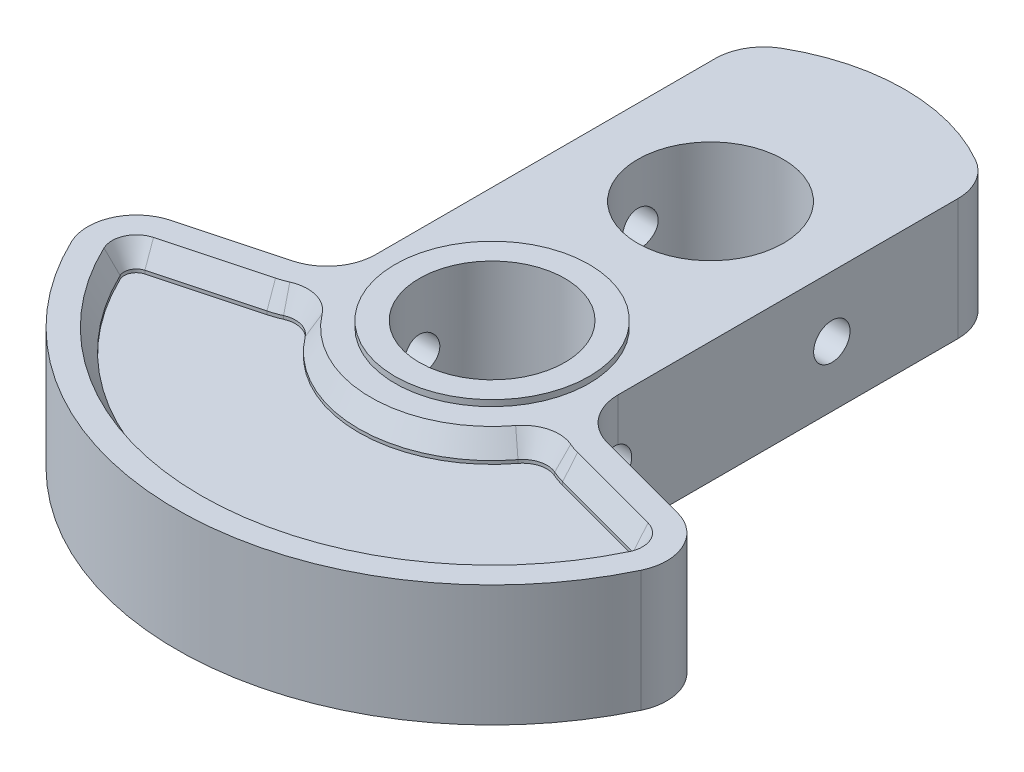
from build123d import *

# Parameters (mm, degrees)
BOSS_EXTRUDE1_DEPTH       = 5
FILLET1_R                 = 4
SKETCH2_R                 = 8
BOSS_EXTRUDE2_DEPTH       = 0.5
SKETCH3_R                 = 8
BOSS_EXTRUDE3_DEPTH       = 0.5
SKETCH4_R                 = 6
CUT_EXTRUDE1_DEPTH        = 43.969085178
CUT_EXTRUDE2_DEPTH        = 2
FILLET3_R                 = 2
CHAMFER1_SIZE             = 1
CHAMFER1_SIZE2            = 1.732050808
FILLET3_OF_MIRROR9_R      = 2
CHAMFER1_OF_MIRROR9_SIZE2 = 1.732050808
CHAMFER1_OF_MIRROR9_SIZE  = 1
CUT_EXTRUDE3_DEPTH        = 42.899788694
CUT_EXTRUDE3_DEPTH_BACK   = 42.899788694
SKETCH7_R                 = 1.5


with BuildPart() as part:
    # Sketch1 → Boss-Extrude1 (new, symmetric)
    with BuildSketch(Plane(origin=(0, 0, 0), x_dir=(1, 0, 0), z_dir=(0, 1, 0))):
        with BuildLine():
            Line((10, 0), (10, 30.489995997))
            ThreePointArc((10, 30.489995997), (0, 34), (-10, 30.489995997))
            Line((-10, 30.489995997), (-10, 0))
            Line((-10, 0), (-10, -2.679491924))
            Line((-10, -2.679491924), (-25.114071484, -6.729295173))
            ThreePointArc((-25.114071484, -6.729295173), (0, -26), (25.114071484, -6.729295173))
            Line((25.114071484, -6.729295173), (10, -2.679491924))
            Line((10, -2.679491924), (10, 0))
        make_face()
    extrude(amount=BOSS_EXTRUDE1_DEPTH, both=True)

    # Fillet1
    fillet1_edges = [part.edges().sort_by_distance(p)[0] for p in [
        (10, 0, 2.679491924),
        (25.114071484, 0, 6.729295173),
        (-25.114071484, 0, 6.729295173),
        (-10, 0, 2.679491924),
        (-10, 0, -30.489995997),
        (10, 0, -30.489995997),
    ]]
    fillet(fillet1_edges, radius=FILLET1_R)

    # Sketch2 → Boss-Extrude2 (add, symmetric)
    with BuildSketch(Plane(origin=(0, 5, 0), x_dir=(1, 0, 0), z_dir=(0, 1, 0))):
        with Locations(Location((0, 0, 0), (0, 0, 90))):
            Circle(SKETCH2_R)
    extrude(amount=BOSS_EXTRUDE2_DEPTH, both=True)

    # Sketch3 → Boss-Extrude3 (add, symmetric)
    with BuildSketch(Plane.XZ.offset(5)):
        with Locations(Location((0, -18, 0), (0, 0, 270))):
            Circle(SKETCH3_R)
    extrude(amount=BOSS_EXTRUDE3_DEPTH, both=True)

    # Sketch4 → Cut-Extrude1 (cut, through all)
    with BuildSketch(Plane(origin=(0, 5.5, 0), x_dir=(1, 0, 0), z_dir=(0, 1, 0))):
        with Locations(Location((0, 0, 0), (0, 0, 270))):
            Circle(SKETCH4_R)
        with Locations(Location((0, 18, 0), (0, 0, 270))):
            Circle(SKETCH4_R)
    extrude(amount=-CUT_EXTRUDE1_DEPTH, mode=Mode.SUBTRACT)

    # Sketch5 → Cut-Extrude2 (cut)
    with BuildSketch(Plane.XZ.offset(5)):
        with BuildLine():
            ThreePointArc((-9.720237296, 5.14946472), (-10.893551196, 5.883139881), (-12.188266684, 6.371664756))
            Line((-12.188266684, 6.371664756), (-20.119713435, 8.496889508))
            ThreePointArc((-20.119713435, 8.496889508), (-20.768948696, 9.043962883), (-20.763662316, 9.892943304))
            ThreePointArc((-20.763662316, 9.892943304), (0, 23), (20.763662316, 9.892943304))
            ThreePointArc((20.763662316, 9.892943304), (20.768948696, 9.043962883), (20.119713435, 8.496889508))
            Line((20.119713435, 8.496889508), (12.188266684, 6.371664756))
            ThreePointArc((12.188266684, 6.371664756), (10.893551196, 5.883139881), (9.720237296, 5.14946472))
            ThreePointArc((9.720237296, 5.14946472), (0, 11), (-9.720237296, 5.14946472))
        make_face()
    cut_extrude2 = extrude(amount=-CUT_EXTRUDE2_DEPTH, mode=Mode.SUBTRACT)

    # Fillet3
    fillet3_edges = [part.edges().sort_by_distance(p)[0] for p in [
        (-9.720237296, -4, 5.14946472),
        (9.720237296, -4, 5.14946472),
    ]]
    fillet(fillet3_edges, radius=FILLET3_R)

    # Chamfer1
    chamfer1_edges = [part.edges().sort_by_distance(p)[0] for p in [
        (0, -5, 11),
        (-11.674313174, -5, 6.212545731),
        (-9.864646178, -5, 5.908245307),
        (9.864646178, -5, 5.908245307),
        (-16.153990059, -5, 7.434277132),
        (16.153990059, -5, 7.434277132),
        (11.674313174, -5, 6.212545731),
        (20.768948696, -5, 9.043962883),
        (0, -5, 23),
        (-20.768948696, -5, 9.043962883),
    ]]
    chamfer1_side = [part.faces().sort_by_distance(p)[0] for p in [
        (-11.929022401, -5, 5.489455054),
    ]]
    chamfer(chamfer1_edges, length=CHAMFER1_SIZE, length2=CHAMFER1_SIZE2, reference=chamfer1_side[0])

    # Mirror9: Cut-Extrude2 across plane
    add(cut_extrude2.mirror(Plane.ZX), mode=Mode.SUBTRACT)

    # Fillet3 of Mirror9
    fillet3_of_mirror9_edges = [part.edges().sort_by_distance(p)[0] for p in [
        (-9.720237296, 4, 5.14946472),
        (9.720237296, 4, 5.14946472),
    ]]
    fillet(fillet3_of_mirror9_edges, radius=FILLET3_OF_MIRROR9_R)

    # Chamfer1 of Mirror9
    chamfer1_of_mirror9_edges = [part.edges().sort_by_distance(p)[0] for p in [
        (0, 5, 11),
        (-11.674313174, 5, 6.212545731),
        (-9.864646178, 5, 5.908245307),
        (9.864646178, 5, 5.908245307),
        (-16.153990059, 5, 7.434277132),
        (16.153990059, 5, 7.434277132),
        (11.674313174, 5, 6.212545731),
        (20.768948696, 5, 9.043962883),
        (0, 5, 23),
        (-20.768948696, 5, 9.043962883),
    ]]
    chamfer(chamfer1_of_mirror9_edges, length=CHAMFER1_OF_MIRROR9_SIZE, length2=CHAMFER1_OF_MIRROR9_SIZE2)

    # Sketch7 → Cut-Extrude3 (cut, two sides: drawn at the far end of the back side and taken through both)
    with BuildSketch(Plane(origin=(0, 0, 0), x_dir=(0, 0, -1), z_dir=(1, 0, 0)).offset(-CUT_EXTRUDE3_DEPTH_BACK)):
        with Locations((18, 0)):
            Circle(SKETCH7_R)
        Circle(SKETCH7_R)
    extrude(amount=CUT_EXTRUDE3_DEPTH + CUT_EXTRUDE3_DEPTH_BACK, mode=Mode.SUBTRACT)


solid = part.part
